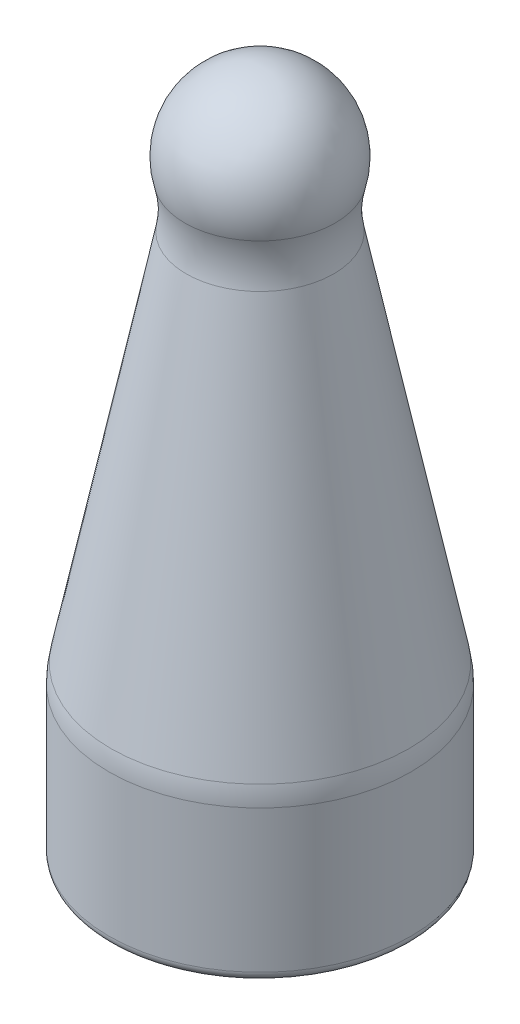
from build123d import *

# Parameters (mm, degrees)
CONG_1_R = 10
CONG_2_R = 1


with BuildPart() as part:
    # Esquisse1 → Révolution2 (revolve)
    with BuildSketch(Plane.XY):
        with BuildLine():
            Line((-12.5, 28.2), (-12.5, 31.5))
            Line((-12.5, 31.5), (-9.5, 31.5))
            Line((-9.5, 31.5), (-9.5, 34.5))
            Line((-9.5, 34.5), (-12.5, 34.5))
            Line((-12.5, 34.5), (-12.5, 37.8))
            Line((-12.5, 37.8), (0, 37.8))
            Line((0, 37.8), (0, 95.8))
            ThreePointArc((0, 95.8), (-6.891439137, 91.863012013), (-7, 83.927016654))
            Line((-7, 83.927016654), (-15.5, 41.8))
            Line((-15.5, 41.8), (-15.5, 25.2))
            Line((-15.5, 25.2), (-12.5, 25.2))
            Line((-12.5, 25.2), (-9.5, 25.2))
            Line((-9.5, 25.2), (-9.5, 28.2))
            Line((-9.5, 28.2), (-12.5, 28.2))
        make_face()
    revolve(axis=Axis((0, 95.8, 0), (0, -1, 0)))

    # Congé1
    cong_1_edges = [part.edges().sort_by_distance(p)[0] for p in [
        (15.5, 41.8, 0),
        (7, 83.927016654, 0),
    ]]
    fillet(cong_1_edges, radius=CONG_1_R)

    # Congé2
    cong_2_edges = [part.edges().sort_by_distance(p)[0] for p in [
        (15.5, 25.2, 0),
    ]]
    fillet(cong_2_edges, radius=CONG_2_R)


solid = part.part
